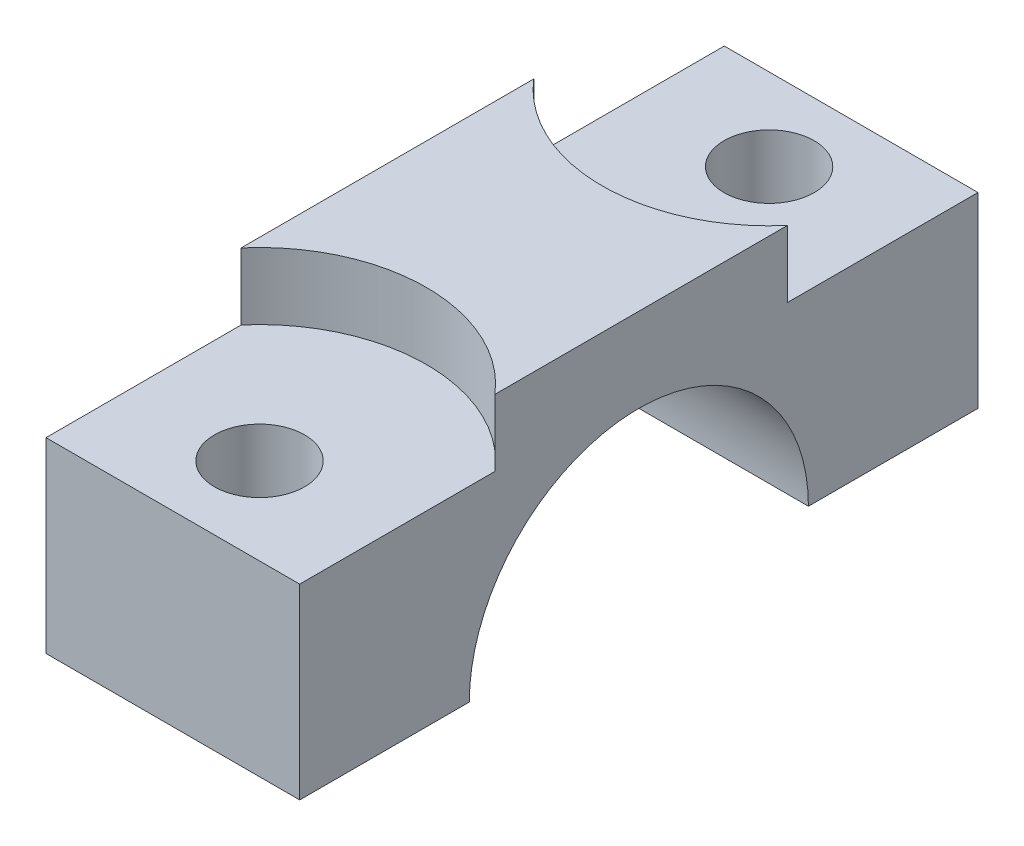
from build123d import *

# Parameters (mm, degrees)
BOSS_EXTRUDE1_DEPTH                           = 9.5
CBORE_FOR_M12_HEX_HEAD_CAP_SCREW1_D           = 6.75
CBORE_FOR_M12_HEX_HEAD_CAP_SCREW1_DEPTH       = 16.51
CBORE_FOR_M12_HEX_HEAD_CAP_SCREW1_CBORE_D     = 25
CBORE_FOR_M12_HEX_HEAD_CAP_SCREW1_CBORE_DEPTH = 5
CBORE_FOR_M12_HEX_HEAD_CAP_SCREW1_TIP         = 2.027904589


with BuildPart() as part:
    # Sketch1 → Boss-Extrude1 (new, symmetric)
    with BuildSketch(Plane(origin=(0, 0, 0), x_dir=(0, 0, -1), z_dir=(1, 0, 0))):
        with BuildLine():
            Line((12.7, 0), (25.4, 0))
            Line((25.4, 0), (25.4, 19))
            Line((25.4, 19), (-25.4, 19))
            Line((-25.4, 19), (-25.4, 0))
            Line((-25.4, 0), (-12.7, 0))
            ThreePointArc((-12.7, 0), (0, 12.7), (12.7, 0))
        make_face()
    extrude(amount=BOSS_EXTRUDE1_DEPTH, both=True)

    # CBORE for M12 Hex Head Cap Screw1
    with Locations(Plane(origin=(0, 19, 0), x_dir=(1, 0, 0), z_dir=(0, 1, 0))):
        with Locations((0, 19.25446783), (0, -18.9082378)):
            CounterBoreHole(CBORE_FOR_M12_HEX_HEAD_CAP_SCREW1_D / 2, CBORE_FOR_M12_HEX_HEAD_CAP_SCREW1_CBORE_D / 2, CBORE_FOR_M12_HEX_HEAD_CAP_SCREW1_CBORE_DEPTH, depth=CBORE_FOR_M12_HEX_HEAD_CAP_SCREW1_DEPTH)
            with Locations((0, 0, -(CBORE_FOR_M12_HEX_HEAD_CAP_SCREW1_DEPTH + CBORE_FOR_M12_HEX_HEAD_CAP_SCREW1_TIP / 2))):  # 118° drill point
                Cone(0, CBORE_FOR_M12_HEX_HEAD_CAP_SCREW1_D / 2, CBORE_FOR_M12_HEX_HEAD_CAP_SCREW1_TIP, mode=Mode.SUBTRACT)


solid = part.part
